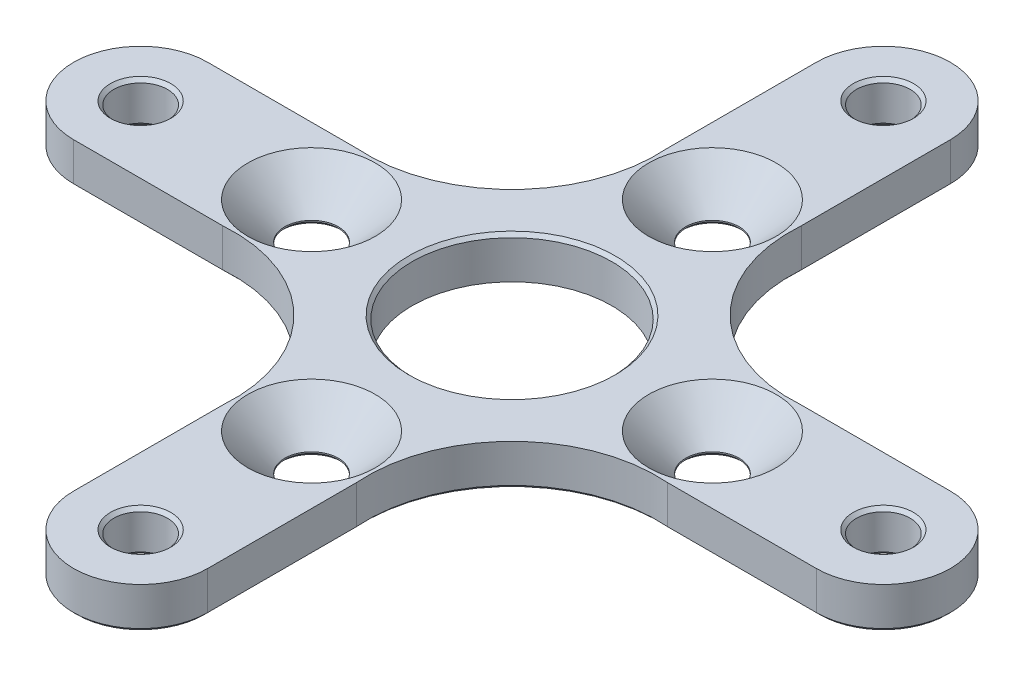
from build123d import *

# Parameters (mm, degrees)
SKETCH1_R           = 7.45
SKETCH1_R_2         = 2
BOSS_EXTRUDE1_DEPTH = 3.1
CIRPATTERN1_COUNT   = 4
CHAMFER3_SIZE       = 0.25
CHAMFER4_SIZE       = 2.75
CHAMFER5_SIZE       = 0.25


with BuildPart() as part:
    # Sketch1 → Boss-Extrude1 (new body)
    with BuildSketch(Plane(origin=(0, 0, 0), x_dir=(1, 0, 0), z_dir=(0, 1, 0))):
        with BuildLine():
            Line((5, 16.58427681), (5, 27.7))
            ThreePointArc((5, 27.7), (0, 32.7), (-5, 27.7))
            Line((-5, 27.7), (-5, 16.58427681))
            ThreePointArc((-5, 16.58427681), (-4.969037433, 15.767138405), (-5, 14.95))
            ThreePointArc((-5, 14.95), (-5.95461278, 11.260107735), (-8.131727984, 8.131727984))
            ThreePointArc((-8.131727984, 8.131727984), (0, -11.5), (8.131727984, 8.131727984))
            ThreePointArc((8.131727984, 8.131727984), (5.95461278, 11.260107735), (5, 14.95))
            ThreePointArc((5, 14.95), (4.969037433, 15.767138405), (5, 16.58427681))
        make_face()
        with Locations(Location((0, 0, 0), (0, 0, 90))):
            Circle(SKETCH1_R, mode=Mode.SUBTRACT)
        with Locations(Location((0, 14.95, 0), (0, 0, 90))):
            Circle(SKETCH1_R_2, mode=Mode.SUBTRACT)
        with Locations(Location((0, 27.7, 0), (0, 0, 90))):
            Circle(SKETCH1_R_2, mode=Mode.SUBTRACT)
    extrude(amount=BOSS_EXTRUDE1_DEPTH)


with BuildPart() as cirpattern1_1:
    # CirPattern1: pattern copy
    add(part.part.rotate(Axis((0, 0, 0), (0, 1, 0)), 1 * 360 / CIRPATTERN1_COUNT))


with BuildPart() as cirpattern1_2:
    # CirPattern1: pattern copy
    add(part.part.rotate(Axis((0, 0, 0), (0, 1, 0)), 2 * 360 / CIRPATTERN1_COUNT))


with BuildPart() as cirpattern1_3:
    # CirPattern1: pattern copy
    add(part.part.rotate(Axis((0, 0, 0), (0, 1, 0)), 3 * 360 / CIRPATTERN1_COUNT))


with BuildPart() as cirpattern1_1_1:
    add(cirpattern1_1.part)

    # Combine1: union part, CirPattern1_3, CirPattern1_2
    add(part.part)
    add(cirpattern1_3.part)
    add(cirpattern1_2.part)

    # Chamfer3
    chamfer3_edges = [cirpattern1_1_1.edges().sort_by_distance(p)[0] for p in [
        (-25.7, 3.1, 0),
        (0, 3.1, -25.7),
        (25.7, 3.1, 0),
        (0, 3.1, 25.7),
        (7.45, 3.1, 0),
    ]]
    chamfer(chamfer3_edges, length=CHAMFER3_SIZE)

    # Chamfer4
    chamfer4_edges = [cirpattern1_1_1.edges().sort_by_distance(p)[0] for p in [
        (-12.95, 3.1, 0),
        (0, 3.1, -12.95),
        (12.95, 3.1, 0),
        (0, 3.1, 12.95),
    ]]
    chamfer(chamfer4_edges, length=CHAMFER4_SIZE)

    # Chamfer5
    chamfer5_edges = [cirpattern1_1_1.edges().sort_by_distance(p)[0] for p in [
        (-32.7, 0, 0),
        (-22.142138405, 0, -5),
        (-8.131727984, 0, -8.131727984),
        (-8.131727984, 0, 8.131727984),
        (-22.142138405, 0, 5),
        (-25.7, 0, 0),
        (-12.95, 0, 0),
        (0, 0, -25.7),
        (0, 0, -12.95),
        (8.131727984, 0, -8.131727984),
        (5, 0, -22.142138405),
        (25.7, 0, 0),
        (12.95, 0, 0),
        (8.131727984, 0, 8.131727984),
        (22.142138405, 0, 5),
        (0, 0, 25.7),
        (0, 0, 12.95),
        (-5, 0, 22.142138405),
        (-5, 0, -22.142138405),
        (0, 0, -32.7),
        (22.142138405, 0, -5),
        (32.7, 0, 0),
        (5, 0, 22.142138405),
        (0, 0, 32.7),
    ]]
    chamfer(chamfer5_edges, length=CHAMFER5_SIZE)


solid = cirpattern1_1_1.part
